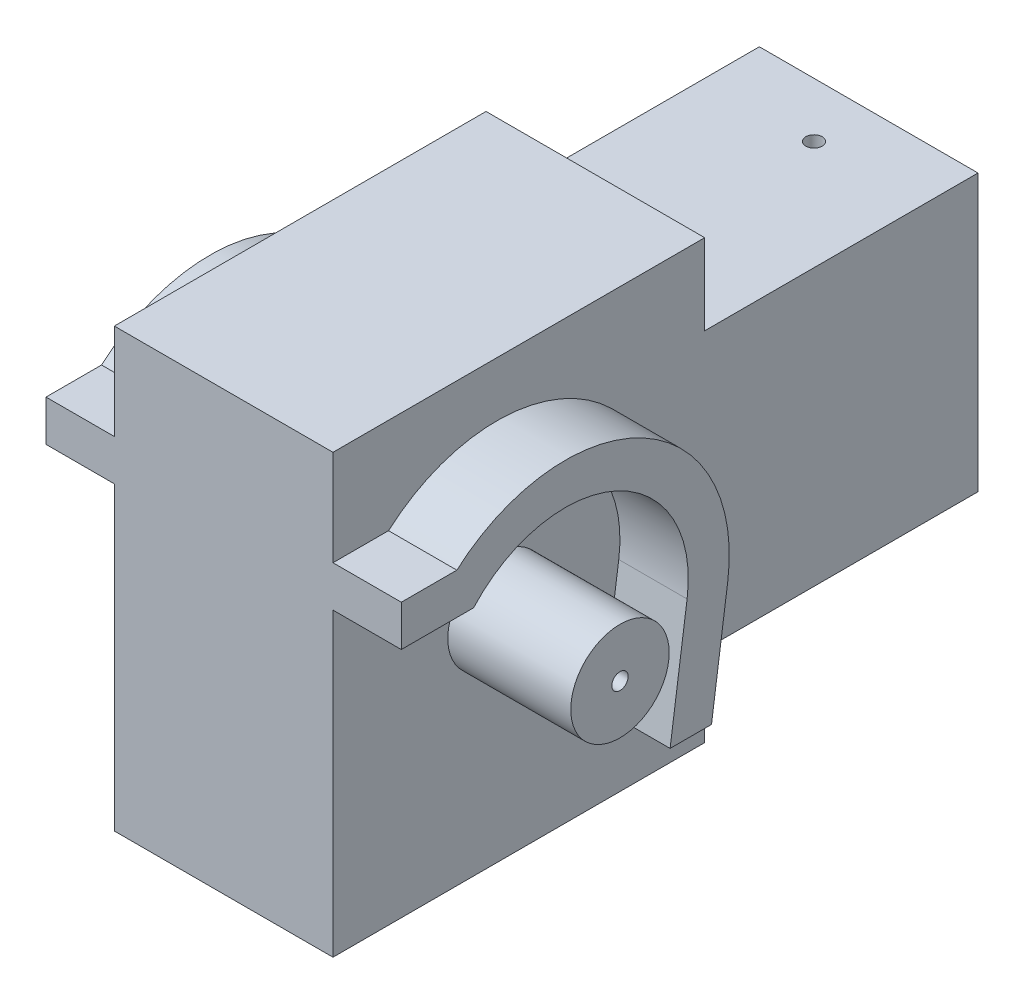
from build123d import *

# Parameters (mm, degrees)
SKETCH_2_W           = 23.6
SKETCH_2_H           = 16
EXTRUDE_1_DEPTH      = 4
EXTRUDE_START        = 4
EXTRUDE_3_DEPTH      = 4.5
SKETCH_5_R           = 0.3
CUT_EXTRUDE_10_DEPTH = 1
EXTRUDE_2_DEPTH      = 2.5
SKETCH_6_W           = 4
SKETCH_6_H           = 2.95
CUT_EXTRUDE_11_DEPTH = 10
SKETCH_7_R           = 0.3
CUT_EXTRUDE_12_DEPTH = 24.50132975
SKETCH_8_W           = 13.6
SKETCH_8_H           = 2.95
CUT_EXTRUDE_13_DEPTH = 2.5


with BuildPart() as part:
    # 草图2 → 凸台-拉伸1 (new body)
    with BuildSketch(Plane(origin=(0, 0, 0), x_dir=(0, 0, -1), z_dir=(1, 0, 0))):
        with Locations((5.8, 0)):
            Rectangle(SKETCH_2_W, SKETCH_2_H)
    extrude(amount=EXTRUDE_1_DEPTH)

    # 草图2<10> → 凸台-拉伸3 (add)
    with BuildSketch(Plane(origin=(0, 0, 0), x_dir=(0, 0, -1), z_dir=(1, 0, 0)).offset(EXTRUDE_START)):
        with BuildLine():
            ThreePointArc((0, -1.8), (1.272792206, -1.272792206), (1.8, 0))
            Line((1.8, 0), (0, 0))
            Line((0, 0), (0, -1.8))
        make_face()
        with BuildLine():
            Line((0, 0), (1.8, 0))
            ThreePointArc((1.8, 0), (1.272792206, 1.272792206), (0, 1.8))
            Line((0, 1.8), (0, 0))
        make_face()
        with BuildLine():
            Line((0, -1.8), (0, 0))
            Line((0, 0), (-1.8, 0))
            ThreePointArc((-1.8, 0), (-1.272792206, -1.272792206), (0, -1.8))
        make_face()
        with BuildLine():
            Line((-1.8, 0), (0, 0))
            Line((0, 0), (0, 1.8))
            ThreePointArc((0, 1.8), (-1.272792206, 1.272792206), (-1.8, 0))
        make_face()
    extrude(amount=EXTRUDE_3_DEPTH)

    # 草图5 → 切除-拉伸10 (cut)
    with BuildSketch(Plane(origin=(8.5, 0, 0), x_dir=(0, 0, -1), z_dir=(1, 0, 0))):
        Circle(SKETCH_5_R)
    extrude(amount=-CUT_EXTRUDE_10_DEPTH, mode=Mode.SUBTRACT)

    # 草图2<4> → 凸台-拉伸2 (add)
    with BuildSketch(Plane(origin=(0, 0, 0), x_dir=(0, 0, -1), z_dir=(1, 0, 0)).offset(EXTRUDE_START)):
        with BuildLine():
            ThreePointArc((-3.354101966, 3), (-1.837117307, 4.107919181), (0, 4.5))
            Line((0, 4.5), (-3.968626967, 4.5))
            ThreePointArc((-3.968626967, 4.5), (-4.643360347, 3.799895352), (-5.196152423, 3))
            Line((-5.196152423, 3), (-3.354101966, 3))
        make_face()
        with BuildLine():
            Line((0, 5), (1.8, 5))
            Line((1.8, 5), (1.8, 5.723635209))
            ThreePointArc((1.8, 5.723635209), (-1.245012655, 5.869407422), (-3.968626967, 4.5))
            Line((-3.968626967, 4.5), (0, 4.5))
            Line((0, 4.5), (0, 5))
        make_face()
        with BuildLine():
            ThreePointArc((0, 4.5), (0.919393397, 4.405078408), (1.8, 4.124318125))
            Line((1.8, 4.124318125), (1.8, 5))
            Line((1.8, 5), (0, 5))
            Line((0, 5), (0, 4.5))
        make_face()
        with BuildLine():
            ThreePointArc((1.8, 4.124318125), (3.764970119, 2.464751509), (4.5, 0))
            Line((4.5, 0), (6, 0))
            ThreePointArc((6, 0), (5.286764074, 2.837274331), (3.31662479, 5))
            Line((3.31662479, 5), (1.8, 5))
            Line((1.8, 5), (1.8, 4.124318125))
        make_face()
        with BuildLine():
            Line((1.8, 5.723635209), (1.8, 5))
            Line((1.8, 5), (3.31662479, 5))
            ThreePointArc((3.31662479, 5), (2.583771331, 5.415175501), (1.8, 5.723635209))
        make_face()
        with BuildLine():
            Line((6, 0), (4.5, 0))
            ThreePointArc((4.5, 0), (4.489038226, -0.313904132), (4.456206309, -0.626278954))
            Line((4.456206309, -0.626278954), (3.903880188, -4.556283516))
            ThreePointArc((3.903880188, -4.556283516), (5.262635021, -2.881782892), (5.941608412, -0.835038606))
            ThreePointArc((5.941608412, -0.835038606), (5.985384302, -0.418538842), (6, 0))
        make_face()
        with BuildLine():
            Line((5.356261262, -5), (5.941608412, -0.835038606))
            ThreePointArc((5.941608412, -0.835038606), (5.262635021, -2.881782892), (3.903880188, -4.556283516))
            Line((3.903880188, -4.556283516), (3.841519903, -5))
            Line((3.841519903, -5), (5.356261262, -5))
        make_face()
        Polygon((4.934638757, -8), (5.356261262, -5), (3.841519903, -5), (3.419897399, -8), align=None)
        with BuildLine():
            ThreePointArc((-5.196152423, 3), (-4.643360347, 3.799895352), (-3.968626967, 4.5))
            Line((-3.968626967, 4.5), (-6, 4.5))
            Line((-6, 4.5), (-6, 3))
            Line((-6, 3), (-5.196152423, 3))
        make_face()
    extrude(amount=EXTRUDE_2_DEPTH)

    # 草图6 → 切除-拉伸11 (cut)
    with BuildSketch(Plane(origin=(0, 0, -17.6), x_dir=(-1, 0, 0), z_dir=(0, 0, -1))):
        with Locations((-2, 6.525)):
            Rectangle(SKETCH_6_W, SKETCH_6_H)
        with Locations((-2, -6.525)):
            Rectangle(SKETCH_6_W, SKETCH_6_H)
    extrude(amount=-CUT_EXTRUDE_11_DEPTH, mode=Mode.SUBTRACT)

    # 草图7 → 切除-拉伸12 (cut, through all)
    with BuildSketch(Plane.XZ.offset(5.05)):
        with Locations((0, -9.6)):
            Circle(SKETCH_7_R)
        with Locations((0, -15.6)):
            Circle(SKETCH_7_R)
    extrude(amount=-CUT_EXTRUDE_12_DEPTH, mode=Mode.SUBTRACT)

    # 草图8 → 切除-拉伸13 (cut)
    with BuildSketch(Plane(origin=(6.5, 0, 0), x_dir=(0, 0, -1), z_dir=(1, 0, 0))):
        with Locations((0.8, -6.525)):
            Rectangle(SKETCH_8_W, SKETCH_8_H)
    extrude(amount=-CUT_EXTRUDE_13_DEPTH, mode=Mode.SUBTRACT)

    # 镜向1: part across plane


with BuildPart() as part_1:
    add(part.part)
    add(part.part.mirror(Plane(origin=(0, 0, 0), x_dir=(0, 0, 1), z_dir=(1, 0, 0))))


solid = part_1.part
